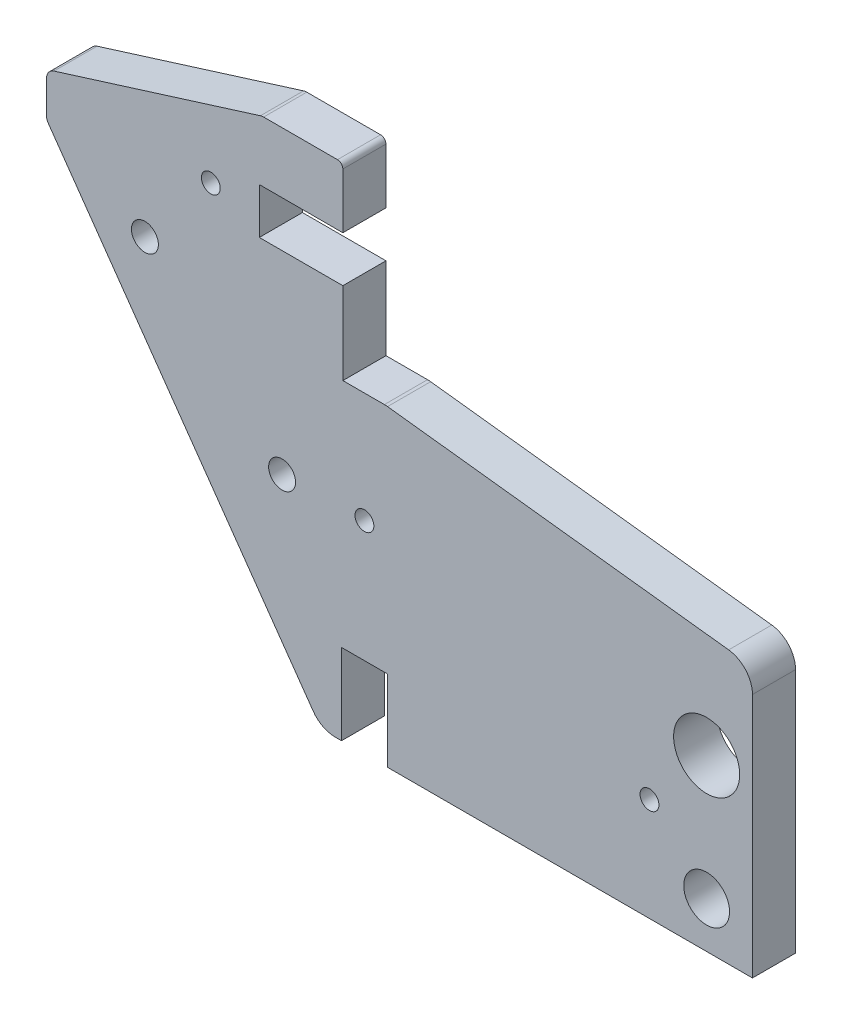
from build123d import *

# Parameters (mm, degrees)
SKETCH2_R          = 6.125
SKETCH2_R_2        = 4.25
SKETCH2_R_3        = 1.75
EXTRUDE1_DEPTH     = 8
SKETCH3_W          = 8.5
SKETCH3_H          = 15
SKETCH3_W_2        = 15.5
SKETCH3_H_2        = 8.5
EXTRUDE2_DEPTH     = 10
SKETCH4_R          = 2.5
CUT_EXTRUDE1_DEPTH = 169.256392057


with BuildPart() as part:
    # Sketch2 → Extrude1 (new body)
    with BuildSketch(Plane.XY):
        with BuildLine():
            Line((59.608556798, 87.780072478), (59.608556798, 79.780072478))
            Line((59.608556798, 79.780072478), (59.608556798, 64.280072478))
            Line((59.608556798, 64.280072478), (67.315449876, 64.280072478))
            ThreePointArc((67.315449876, 64.280072478), (67.608054466, 64.27150339), (67.899656114, 64.2458255))
            Line((67.899656114, 64.2458255), (131.192763036, 56.799577626))
            ThreePointArc((131.192763036, 56.799577626), (134.344934134, 55.156396561), (135.608556798, 51.833824605))
            Line((135.608556798, 51.833824605), (135.608556798, 6.280072478))
            Line((135.608556798, 6.280072478), (67.608556798, 6.280072478))
            Line((67.608556798, 6.280072478), (59.608556798, 6.280072478))
            Line((59.608556798, 6.280072478), (58.204496826, 6.280072478))
            ThreePointArc((58.204496826, 6.280072478), (55.900569943, 6.842514488), (54.114973167, 8.403304111))
            Line((54.114973167, 8.403304111), (4.972747334, 78.262350637))
            ThreePointArc((4.972747334, 78.262350637), (4.70177693, 78.809575974), (4.608556798, 79.413057984))
            Line((4.608556798, 79.413057984), (4.608556798, 85.309690651))
            ThreePointArc((4.608556798, 85.309690651), (4.997175407, 86.494363608), (6.012006812, 87.218650607))
            Line((6.012006812, 87.218650607), (44.317228657, 99.189032434))
            ThreePointArc((44.317228657, 99.189032434), (44.612050216, 99.257181467), (44.913778644, 99.280072478))
            Line((44.913778644, 99.280072478), (58.608556798, 99.280072478))
            ThreePointArc((58.608556798, 99.280072478), (59.315663579, 98.987179259), (59.608556798, 98.280072478))
            Line((59.608556798, 98.280072478), (59.608556798, 87.780072478))
        make_face()
        with Locations((127.108556798, 37.780072478)):
            Circle(SKETCH2_R, mode=Mode.SUBTRACT)
        with Locations((127.108556798, 14.780072478)):
            Circle(SKETCH2_R_2, mode=Mode.SUBTRACT)
        with Locations((116.501954798, 25.386674196)):
            Circle(SKETCH2_R_3, mode=Mode.SUBTRACT)
        with Locations((63.608556798, 43.780072478)):
            Circle(SKETCH2_R_3, mode=Mode.SUBTRACT)
        with Locations((35.108556798, 83.780072478)):
            Circle(SKETCH2_R_3, mode=Mode.SUBTRACT)
    extrude(amount=EXTRUDE1_DEPTH)

    # Sketch3 → Extrude2 (cut)
    with BuildSketch(Plane.XY.offset(8)):
        with Locations((63.608556798, 13.780072478)):
            Rectangle(SKETCH3_W, SKETCH3_H)
        with Locations((51.858556798, 83.780072478)):
            Rectangle(SKETCH3_W_2, SKETCH3_H_2)
    extrude(amount=-EXTRUDE2_DEPTH, mode=Mode.SUBTRACT)

    # Sketch4 → Cut-Extrude1 (cut, through all)
    with BuildSketch(Plane(origin=(0, 0, 0), x_dir=(-1, 0, 0), z_dir=(0, 0, -1))):
        with Locations((-22.880634737, 69.007994539)):
            Circle(SKETCH4_R)
        with Locations((-48.336478859, 43.552150417)):
            Circle(SKETCH4_R)
    extrude(amount=-CUT_EXTRUDE1_DEPTH, mode=Mode.SUBTRACT)


solid = part.part
